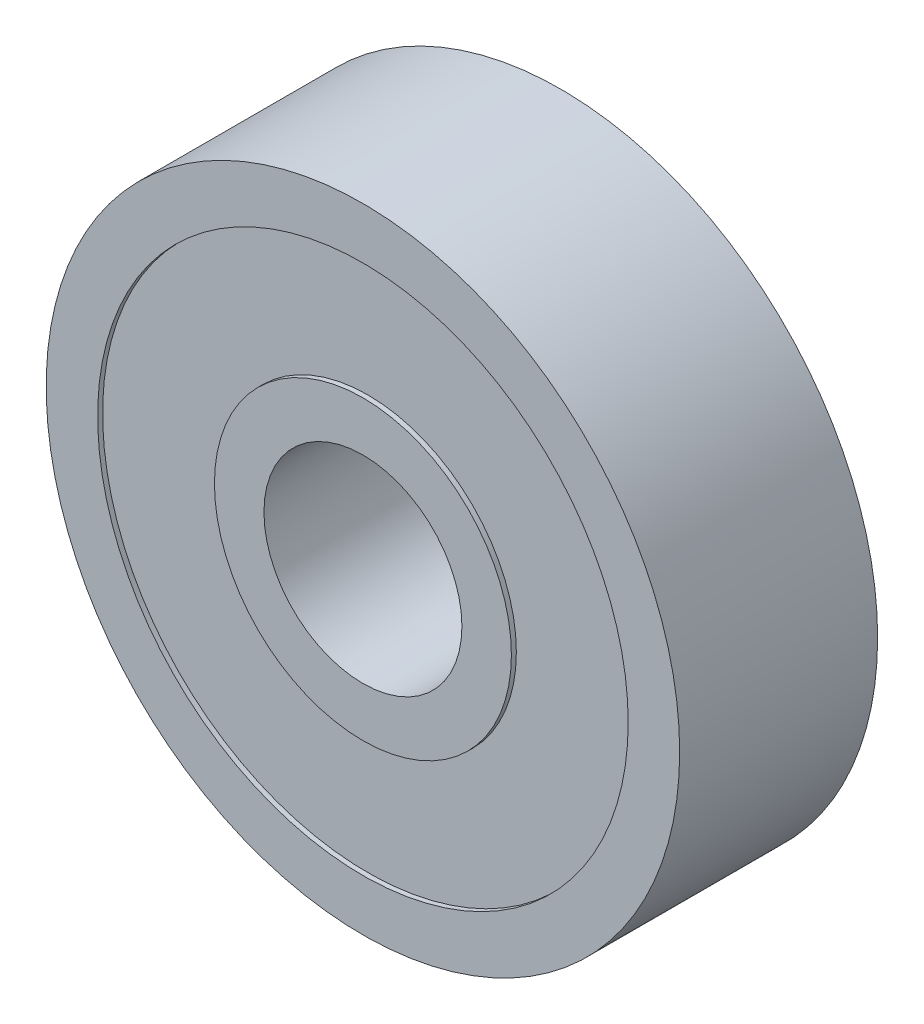
from build123d import *

# Parameters (mm, degrees)
BOSS_EXTRUDE1_DEPTH        = 2.5
BOSS_EXTRUDE1_DEPTH_BACK   = 2.5
SKETCH1_R                  = 8
SKETCH1_R_2                = 6.7
BOSS_EXTRUDE1_2_DEPTH      = 2.5
BOSS_EXTRUDE1_2_DEPTH_BACK = 2.5
SKETCH1_R_3                = 3.75
SKETCH1_R_4                = 2.5
BOSS_EXTRUDE2_DEPTH        = 2.375
BOSS_EXTRUDE2_DEPTH_BACK   = 2.375
SKETCH1_3_R                = 6.7
SKETCH1_3_R_2              = 3.75


with BuildPart() as part:
    # Sketch1 → Boss-Extrude1 (new, two sides: drawn at the far end of the back side and taken through both)
    with BuildSketch(Plane.XY.offset(-BOSS_EXTRUDE1_DEPTH_BACK)):
        Circle(SKETCH1_R)
        Circle(SKETCH1_R_2, mode=Mode.SUBTRACT)
    extrude(amount=BOSS_EXTRUDE1_DEPTH + BOSS_EXTRUDE1_DEPTH_BACK)



with BuildPart() as body_2:
    # Sketch1 → Boss-Extrude1 2 (new, two sides: drawn at the far end of the back side and taken through both)
    with BuildSketch(Plane.XY.offset(-BOSS_EXTRUDE1_2_DEPTH_BACK)):
        Circle(SKETCH1_R_3)
        Circle(SKETCH1_R_4, mode=Mode.SUBTRACT)
    extrude(amount=BOSS_EXTRUDE1_2_DEPTH + BOSS_EXTRUDE1_2_DEPTH_BACK)


with BuildPart() as part_1:
    add(part.part)

    add(body_2.part)  # Boss-Extrude2 merges body 2
    # Sketch1<3> → Boss-Extrude2 (add, two sides: drawn at the far end of the back side and taken through both)
    with BuildSketch(Plane.XY.offset(-BOSS_EXTRUDE2_DEPTH_BACK)):
        Circle(SKETCH1_3_R)
        Circle(SKETCH1_3_R_2, mode=Mode.SUBTRACT)
    extrude(amount=BOSS_EXTRUDE2_DEPTH + BOSS_EXTRUDE2_DEPTH_BACK)


solid = part_1.part
